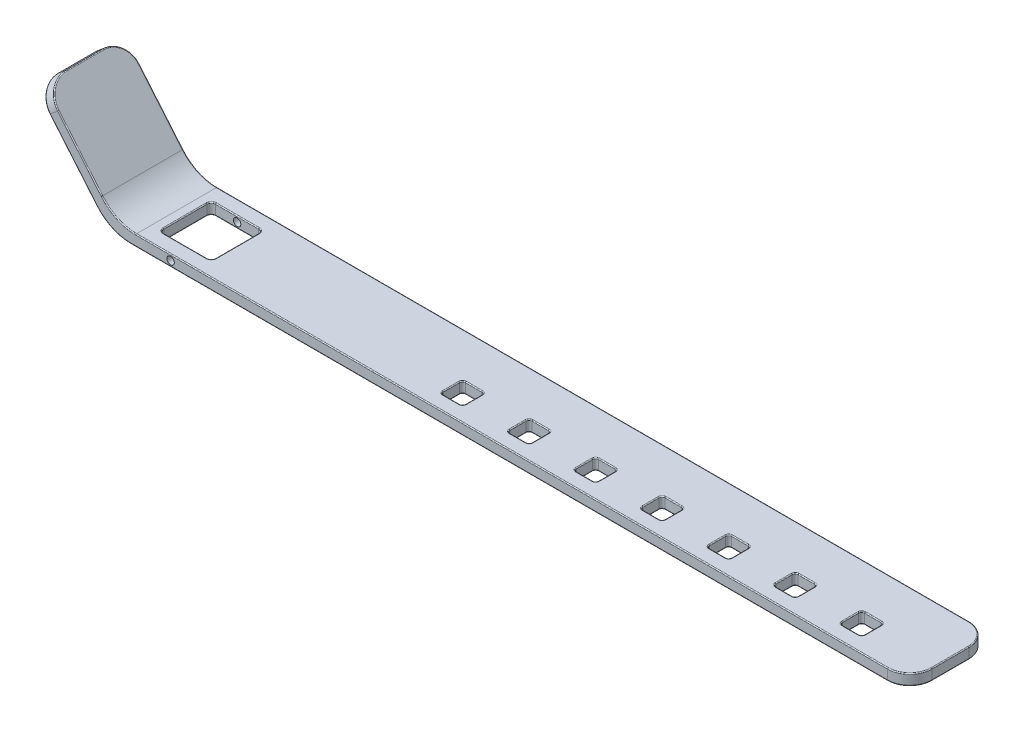
from build123d import *

# Parameters (mm, degrees)
BOSS_EXTRUDE1_DEPTH      = 11
BOSS_EXTRUDE1_DEPTH_BACK = 11
SKETCH1_R                = 1
FILLET1_R                = 6
CUT_EXTRUDE1_REACH       = 124.675
FILLET2_R                = 0.25


with BuildPart() as part:
    # Sketch1 → Boss-Extrude1 (new, two sides: drawn at the far end of the back side and taken through both)
    with BuildSketch(Plane.XY.offset(-BOSS_EXTRUDE1_DEPTH_BACK)):
        with BuildLine():
            Line((-98.59684142, 5.786548684), (-114.283628291, 24.481333294))
            Line((-114.283628291, 24.481333294), (-116.58176162, 22.552970465))
            Line((-116.58176162, 22.552970465), (-99.995764394, 2.786548684))
            ThreePointArc((-99.995764394, 2.786548684), (-95.874650217, -0.375693444), (-90.803231077, -1.5))
            Line((-90.803231077, -1.5), (120, -1.5))
            Line((120, -1.5), (120, 1.5))
            Line((120, 1.5), (-89.404308102, 1.5))
            ThreePointArc((-89.404308102, 1.5), (-94.475727243, 2.624306556), (-98.59684142, 5.786548684))
        make_face()
        with Locations((-80, 0)):
            Circle(SKETCH1_R, mode=Mode.SUBTRACT)
    extrude(amount=BOSS_EXTRUDE1_DEPTH + BOSS_EXTRUDE1_DEPTH_BACK)

    # Fillet1
    fillet1_edges = [part.edges().sort_by_distance(p)[0] for p in [
        (-115.432694955, 23.517151879, -11),
        (-115.432694955, 23.517151879, 11),
        (120, 0, 11),
        (120, 0, -11),
    ]]
    fillet(fillet1_edges, radius=FILLET1_R)

    # Sketch2 → Cut-Extrude1 (cut, up to next)
    with BuildSketch(Plane(origin=(0, 1.5, 0), x_dir=(1, 0, 0), z_dir=(0, 1, 0)), mode=Mode.PRIVATE) as cut_extrude1_sk1:
        with BuildLine():
            Line((-85.8, 7), (-74.2, 7))
            ThreePointArc((-74.2, 7), (-73.351471863, 6.648528137), (-73, 5.8))
            Line((-73, 5.8), (-73, -5.8))
            ThreePointArc((-73, -5.8), (-73.351471863, -6.648528137), (-74.2, -7))
            Line((-74.2, -7), (-85.8, -7))
            ThreePointArc((-85.8, -7), (-86.648528137, -6.648528137), (-87, -5.8))
            Line((-87, -5.8), (-87, 5.8))
            ThreePointArc((-87, 5.8), (-86.648528137, 6.648528137), (-85.8, 7))
        make_face()
    cut_extrude1_tool1 = extrude(cut_extrude1_sk1.sketch, amount=-CUT_EXTRUDE1_REACH, mode=Mode.PRIVATE) & part.part
    # Sketch2 → Cut-Extrude1 (cut, up to next)
    with BuildSketch(Plane(origin=(0, 1.5, 0), x_dir=(1, 0, 0), z_dir=(0, 1, 0)), mode=Mode.PRIVATE) as cut_extrude1_sk2:
        with BuildLine():
            Line((79.8, -1), (84.2, -1))
            ThreePointArc((84.2, -1), (84.765685425, -1.234314575), (85, -1.8))
            Line((85, -1.8), (85, -6.2))
            ThreePointArc((85, -6.2), (84.765685425, -6.765685425), (84.2, -7))
            Line((84.2, -7), (79.8, -7))
            ThreePointArc((79.8, -7), (79.234314575, -6.765685425), (79, -6.2))
            Line((79, -6.2), (79, -1.8))
            ThreePointArc((79, -1.8), (79.234314575, -1.234314575), (79.8, -1))
        make_face()
    cut_extrude1_tool2 = extrude(cut_extrude1_sk2.sketch, amount=-CUT_EXTRUDE1_REACH, mode=Mode.PRIVATE) & part.part
    # Sketch2 → Cut-Extrude1 (cut, up to next)
    with BuildSketch(Plane(origin=(0, 1.5, 0), x_dir=(1, 0, 0), z_dir=(0, 1, 0)), mode=Mode.PRIVATE) as cut_extrude1_sk3:
        with BuildLine():
            Line((97.8, -1), (102.2, -1))
            ThreePointArc((102.2, -1), (102.765685425, -1.234314575), (103, -1.8))
            Line((103, -1.8), (103, -6.2))
            ThreePointArc((103, -6.2), (102.765685425, -6.765685425), (102.2, -7))
            Line((102.2, -7), (97.8, -7))
            ThreePointArc((97.8, -7), (97.234314575, -6.765685425), (97, -6.2))
            Line((97, -6.2), (97, -1.8))
            ThreePointArc((97, -1.8), (97.234314575, -1.234314575), (97.8, -1))
        make_face()
    cut_extrude1_tool3 = extrude(cut_extrude1_sk3.sketch, amount=-CUT_EXTRUDE1_REACH, mode=Mode.PRIVATE) & part.part
    # Sketch2 → Cut-Extrude1 (cut, up to next)
    with BuildSketch(Plane(origin=(0, 1.5, 0), x_dir=(1, 0, 0), z_dir=(0, 1, 0)), mode=Mode.PRIVATE) as cut_extrude1_sk4:
        with BuildLine():
            Line((61.8, -1), (66.2, -1))
            ThreePointArc((66.2, -1), (66.765685425, -1.234314575), (67, -1.8))
            Line((67, -1.8), (67, -6.2))
            ThreePointArc((67, -6.2), (66.765685425, -6.765685425), (66.2, -7))
            Line((66.2, -7), (61.8, -7))
            ThreePointArc((61.8, -7), (61.234314575, -6.765685425), (61, -6.2))
            Line((61, -6.2), (61, -1.8))
            ThreePointArc((61, -1.8), (61.234314575, -1.234314575), (61.8, -1))
        make_face()
    cut_extrude1_tool4 = extrude(cut_extrude1_sk4.sketch, amount=-CUT_EXTRUDE1_REACH, mode=Mode.PRIVATE) & part.part
    # Sketch2 → Cut-Extrude1 (cut, up to next)
    with BuildSketch(Plane(origin=(0, 1.5, 0), x_dir=(1, 0, 0), z_dir=(0, 1, 0)), mode=Mode.PRIVATE) as cut_extrude1_sk5:
        with BuildLine():
            Line((43.8, -1), (48.2, -1))
            ThreePointArc((48.2, -1), (48.765685425, -1.234314575), (49, -1.8))
            Line((49, -1.8), (49, -6.2))
            ThreePointArc((49, -6.2), (48.765685425, -6.765685425), (48.2, -7))
            Line((48.2, -7), (43.8, -7))
            ThreePointArc((43.8, -7), (43.234314575, -6.765685425), (43, -6.2))
            Line((43, -6.2), (43, -1.8))
            ThreePointArc((43, -1.8), (43.234314575, -1.234314575), (43.8, -1))
        make_face()
    cut_extrude1_tool5 = extrude(cut_extrude1_sk5.sketch, amount=-CUT_EXTRUDE1_REACH, mode=Mode.PRIVATE) & part.part
    # Sketch2 → Cut-Extrude1 (cut, up to next)
    with BuildSketch(Plane(origin=(0, 1.5, 0), x_dir=(1, 0, 0), z_dir=(0, 1, 0)), mode=Mode.PRIVATE) as cut_extrude1_sk6:
        with BuildLine():
            Line((25.8, -1), (30.2, -1))
            ThreePointArc((30.2, -1), (30.765685425, -1.234314575), (31, -1.8))
            Line((31, -1.8), (31, -6.2))
            ThreePointArc((31, -6.2), (30.765685425, -6.765685425), (30.2, -7))
            Line((30.2, -7), (25.8, -7))
            ThreePointArc((25.8, -7), (25.234314575, -6.765685425), (25, -6.2))
            Line((25, -6.2), (25, -1.8))
            ThreePointArc((25, -1.8), (25.234314575, -1.234314575), (25.8, -1))
        make_face()
    cut_extrude1_tool6 = extrude(cut_extrude1_sk6.sketch, amount=-CUT_EXTRUDE1_REACH, mode=Mode.PRIVATE) & part.part
    # Sketch2 → Cut-Extrude1 (cut, up to next)
    with BuildSketch(Plane(origin=(0, 1.5, 0), x_dir=(1, 0, 0), z_dir=(0, 1, 0)), mode=Mode.PRIVATE) as cut_extrude1_sk7:
        with BuildLine():
            Line((7.8, -1), (12.2, -1))
            ThreePointArc((12.2, -1), (12.765685425, -1.234314575), (13, -1.8))
            Line((13, -1.8), (13, -6.2))
            ThreePointArc((13, -6.2), (12.765685425, -6.765685425), (12.2, -7))
            Line((12.2, -7), (7.8, -7))
            ThreePointArc((7.8, -7), (7.234314575, -6.765685425), (7, -6.2))
            Line((7, -6.2), (7, -1.8))
            ThreePointArc((7, -1.8), (7.234314575, -1.234314575), (7.8, -1))
        make_face()
    cut_extrude1_tool7 = extrude(cut_extrude1_sk7.sketch, amount=-CUT_EXTRUDE1_REACH, mode=Mode.PRIVATE) & part.part
    # Sketch2 → Cut-Extrude1 (cut, up to next)
    with BuildSketch(Plane(origin=(0, 1.5, 0), x_dir=(1, 0, 0), z_dir=(0, 1, 0)), mode=Mode.PRIVATE) as cut_extrude1_sk8:
        with BuildLine():
            Line((-10.2, -1), (-5.8, -1))
            ThreePointArc((-5.8, -1), (-5.234314575, -1.234314575), (-5, -1.8))
            Line((-5, -1.8), (-5, -6.2))
            ThreePointArc((-5, -6.2), (-5.234314575, -6.765685425), (-5.8, -7))
            Line((-5.8, -7), (-10.2, -7))
            ThreePointArc((-10.2, -7), (-10.765685425, -6.765685425), (-11, -6.2))
            Line((-11, -6.2), (-11, -1.8))
            ThreePointArc((-11, -1.8), (-10.765685425, -1.234314575), (-10.2, -1))
        make_face()
    cut_extrude1_tool8 = extrude(cut_extrude1_sk8.sketch, amount=-CUT_EXTRUDE1_REACH, mode=Mode.PRIVATE) & part.part
    add(cut_extrude1_tool1.solids().sort_by_distance((-80, 1.5, 0))[0], mode=Mode.SUBTRACT)
    add(cut_extrude1_tool2.solids().sort_by_distance((82, 1.5, 4))[0], mode=Mode.SUBTRACT)
    add(cut_extrude1_tool3.solids().sort_by_distance((100, 1.5, 4))[0], mode=Mode.SUBTRACT)
    add(cut_extrude1_tool4.solids().sort_by_distance((64, 1.5, 4))[0], mode=Mode.SUBTRACT)
    add(cut_extrude1_tool5.solids().sort_by_distance((46, 1.5, 4))[0], mode=Mode.SUBTRACT)
    add(cut_extrude1_tool6.solids().sort_by_distance((28, 1.5, 4))[0], mode=Mode.SUBTRACT)
    add(cut_extrude1_tool7.solids().sort_by_distance((10, 1.5, 4))[0], mode=Mode.SUBTRACT)
    add(cut_extrude1_tool8.solids().sort_by_distance((-8, 1.5, 4))[0], mode=Mode.SUBTRACT)

    # Fillet2
    fillet2_edges = [part.edges().sort_by_distance(p)[0] for p in [
        (-95.874650217, -0.375693444, -11),
        (-95.874650217, -0.375693444, 11),
        (-94.475727243, 2.624306556, -11),
        (-94.475727243, 2.624306556, 11),
        (-115.452152828, 21.206755128, 9.242640687),
        (-106.360400178, 10.371626245, 11),
        (-106.360400178, 10.371626245, -11),
        (-115.452152828, 21.206755128, -9.242640687),
        (-116.58176162, 22.552970465, 0),
        (-104.511872026, 12.835807659, 11),
        (-113.154019499, 23.135117957, 9.242640687),
        (-114.283628291, 24.481333294, 0),
        (-113.154019499, 23.135117957, -9.242640687),
        (-104.511872026, 12.835807659, -11),
        (-86.648528137, -1.5, -6.648528137),
        (-80, -1.5, -7),
        (-73.351471863, -1.5, -6.648528137),
        (-73, -1.5, 0),
        (-73.351471863, -1.5, 6.648528137),
        (-80, -1.5, 7),
        (-86.648528137, -1.5, 6.648528137),
        (-87, -1.5, 0),
        (118.242640687, -1.5, -9.242640687),
        (11.598384462, -1.5, -11),
        (11.598384462, -1.5, 11),
        (118.242640687, -1.5, 9.242640687),
        (120, -1.5, 0),
        (-5, -1.5, 4),
        (-5.234314575, -1.5, 6.765685425),
        (-8, -1.5, 7),
        (-10.765685425, -1.5, 6.765685425),
        (-11, -1.5, 4),
        (-10.765685425, -1.5, 1.234314575),
        (-8, -1.5, 1),
        (-5.234314575, -1.5, 1.234314575),
        (13, -1.5, 4),
        (12.765685425, -1.5, 6.765685425),
        (10, -1.5, 7),
        (7.234314575, -1.5, 6.765685425),
        (7, -1.5, 4),
        (7.234314575, -1.5, 1.234314575),
        (10, -1.5, 1),
        (12.765685425, -1.5, 1.234314575),
        (31, -1.5, 4),
        (30.765685425, -1.5, 6.765685425),
        (28, -1.5, 7),
        (25.234314575, -1.5, 6.765685425),
        (25, -1.5, 4),
        (25.234314575, -1.5, 1.234314575),
        (28, -1.5, 1),
        (30.765685425, -1.5, 1.234314575),
        (49, -1.5, 4),
        (48.765685425, -1.5, 6.765685425),
        (46, -1.5, 7),
        (43.234314575, -1.5, 6.765685425),
        (43, -1.5, 4),
        (43.234314575, -1.5, 1.234314575),
        (46, -1.5, 1),
        (48.765685425, -1.5, 1.234314575),
        (67, -1.5, 4),
        (66.765685425, -1.5, 6.765685425),
        (64, -1.5, 7),
        (61.234314575, -1.5, 6.765685425),
        (61, -1.5, 4),
        (61.234314575, -1.5, 1.234314575),
        (64, -1.5, 1),
        (66.765685425, -1.5, 1.234314575),
        (85, -1.5, 4),
        (84.765685425, -1.5, 6.765685425),
        (82, -1.5, 7),
        (79.234314575, -1.5, 6.765685425),
        (79, -1.5, 4),
        (79.234314575, -1.5, 1.234314575),
        (82, -1.5, 1),
        (84.765685425, -1.5, 1.234314575),
        (103, -1.5, 4),
        (102.765685425, -1.5, 6.765685425),
        (100, -1.5, 7),
        (97.234314575, -1.5, 6.765685425),
        (97, -1.5, 4),
        (97.234314575, -1.5, 1.234314575),
        (100, -1.5, 1),
        (102.765685425, -1.5, 1.234314575),
        (12.297845949, 1.5, -11),
        (118.242640687, 1.5, -9.242640687),
        (120, 1.5, 0),
        (118.242640687, 1.5, 9.242640687),
        (12.297845949, 1.5, 11),
        (-8, 1.5, 1),
        (-10.765685425, 1.5, 1.234314575),
        (-11, 1.5, 4),
        (-10.765685425, 1.5, 6.765685425),
        (-8, 1.5, 7),
        (-5.234314575, 1.5, 6.765685425),
        (-5, 1.5, 4),
        (-5.234314575, 1.5, 1.234314575),
        (10, 1.5, 1),
        (7.234314575, 1.5, 1.234314575),
        (7, 1.5, 4),
        (7.234314575, 1.5, 6.765685425),
        (10, 1.5, 7),
        (12.765685425, 1.5, 6.765685425),
        (13, 1.5, 4),
        (12.765685425, 1.5, 1.234314575),
        (28, 1.5, 1),
        (25.234314575, 1.5, 1.234314575),
        (25, 1.5, 4),
        (25.234314575, 1.5, 6.765685425),
        (28, 1.5, 7),
        (30.765685425, 1.5, 6.765685425),
        (31, 1.5, 4),
        (30.765685425, 1.5, 1.234314575),
        (46, 1.5, 1),
        (43.234314575, 1.5, 1.234314575),
        (43, 1.5, 4),
        (43.234314575, 1.5, 6.765685425),
        (46, 1.5, 7),
        (48.765685425, 1.5, 6.765685425),
        (49, 1.5, 4),
        (48.765685425, 1.5, 1.234314575),
        (64, 1.5, 1),
        (61.234314575, 1.5, 1.234314575),
        (61, 1.5, 4),
        (61.234314575, 1.5, 6.765685425),
        (64, 1.5, 7),
        (66.765685425, 1.5, 6.765685425),
        (67, 1.5, 4),
        (66.765685425, 1.5, 1.234314575),
        (82, 1.5, 1),
        (79.234314575, 1.5, 1.234314575),
        (79, 1.5, 4),
        (79.234314575, 1.5, 6.765685425),
        (82, 1.5, 7),
        (84.765685425, 1.5, 6.765685425),
        (85, 1.5, 4),
        (84.765685425, 1.5, 1.234314575),
        (100, 1.5, 1),
        (97.234314575, 1.5, 1.234314575),
        (97, 1.5, 4),
        (97.234314575, 1.5, 6.765685425),
        (100, 1.5, 7),
        (102.765685425, 1.5, 6.765685425),
        (103, 1.5, 4),
        (102.765685425, 1.5, 1.234314575),
        (-80, 1.5, 7),
        (-73.351471863, 1.5, 6.648528137),
        (-73, 1.5, 0),
        (-73.351471863, 1.5, -6.648528137),
        (-80, 1.5, -7),
        (-86.648528137, 1.5, -6.648528137),
        (-87, 1.5, 0),
        (-86.648528137, 1.5, 6.648528137),
    ]]
    fillet(fillet2_edges, radius=FILLET2_R)


solid = part.part
